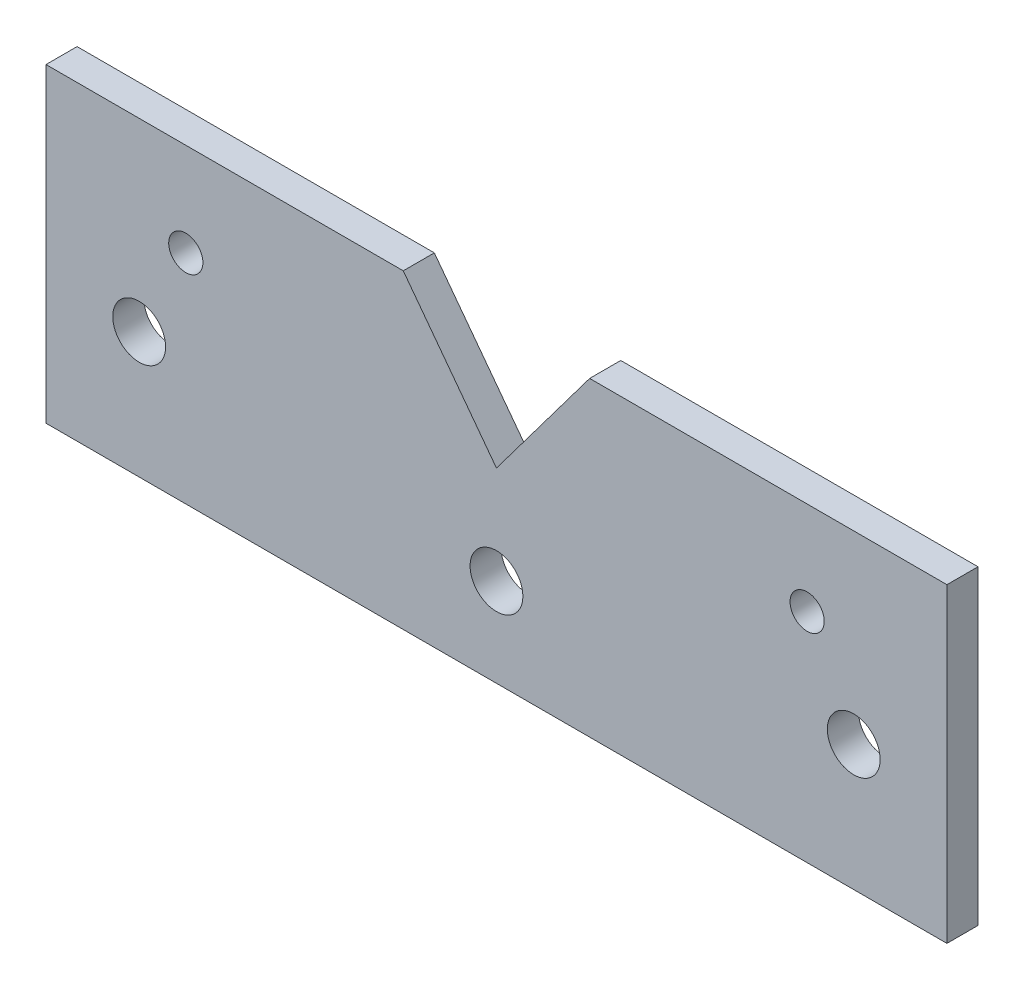
from build123d import *

# Parameters (mm, degrees)
SKETCH1_R           = 4.25
SKETCH1_R_2         = 2.75
BOSS_EXTRUDE1_DEPTH = 5


with BuildPart() as part:
    # Sketch1 → Boss-Extrude1 (new body)
    with BuildSketch(Plane.XY):
        Polygon((0, 0), (0, 50), (57.5, 50), (72.5, 30), (87.5, 50), (145, 50), (145, 0), align=None)
        with Locations((15, 20.25)):
            Circle(SKETCH1_R, mode=Mode.SUBTRACT)
        with Locations((130, 20.25)):
            Circle(SKETCH1_R, mode=Mode.SUBTRACT)
        with Locations((72.5, 14.25)):
            Circle(SKETCH1_R, mode=Mode.SUBTRACT)
        with Locations((22.5, 35)):
            Circle(SKETCH1_R_2, mode=Mode.SUBTRACT)
        with Locations((122.5, 35)):
            Circle(SKETCH1_R_2, mode=Mode.SUBTRACT)
    extrude(amount=BOSS_EXTRUDE1_DEPTH)


solid = part.part
